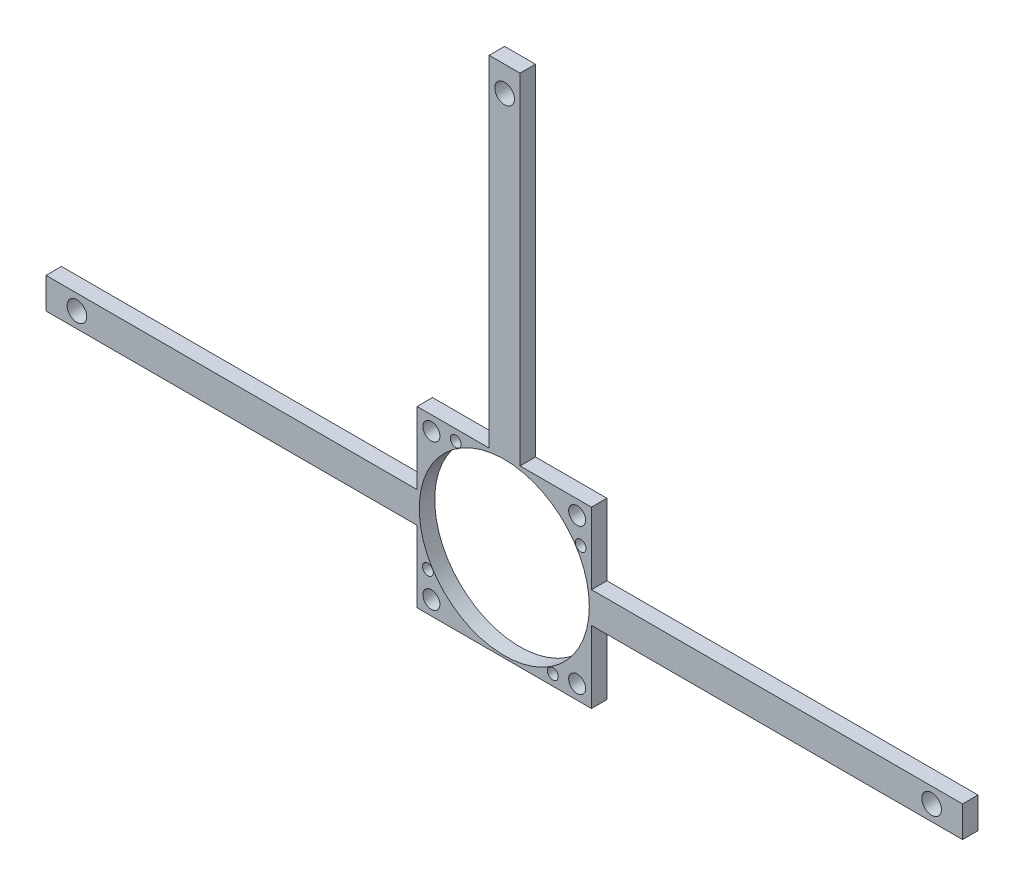
from build123d import *

# Parameters (mm, degrees)
CROQUIS1_R              = 2.75
CROQUIS1_R_2            = 1.75
CROQUIS1_R_3            = 1.747778747
CROQUIS1_R_4            = 7.725412866
SALIENTE_EXTRUIR1_DEPTH = 5
CROQUIS2_R              = 3.175
CROQUIS2_R_2            = 27.5
CORTAR_EXTRUIR1_DEPTH   = 5


with BuildPart() as part:
    # Croquis1 → Saliente-Extruir1 (new body)
    with BuildSketch(Plane.XY):
        Polygon((-28.2, -55.083487529), (-28.2, -31.8), (-4.898409704, -31.8), (-4.898409704, 78.2), (5.101590296, 78.2), (5.101590296, -31.8), (28.2, -31.8), (28.2, -54.916512471), (148.2, -54.916512471), (148.2, -64.916512471), (28.2, -64.916512471), (28.2, -88.2), (-28.2, -88.2), (-28.2, -65.083487529), (-148.2, -65.083487529), (-148.2, -55.083487529), align=None)
        with Locations((-23.57, -36.43)):
            Circle(CROQUIS1_R, mode=Mode.SUBTRACT)
        with Locations((23.57, -36.43)):
            Circle(CROQUIS1_R, mode=Mode.SUBTRACT)
        with Locations((23.57, -83.57)):
            Circle(CROQUIS1_R, mode=Mode.SUBTRACT)
        with Locations((-23.57, -83.57)):
            Circle(CROQUIS1_R, mode=Mode.SUBTRACT)
        with Locations((-15.7, -35.3)):
            Circle(CROQUIS1_R_2, mode=Mode.SUBTRACT)
        with Locations((24.7, -44.3)):
            Circle(CROQUIS1_R_3, mode=Mode.SUBTRACT)
        with Locations((15.7, -84.7)):
            Circle(CROQUIS1_R_2, mode=Mode.SUBTRACT)
        with Locations((-24.7, -75.7)):
            Circle(CROQUIS1_R_2, mode=Mode.SUBTRACT)
        with Locations((0, -60)):
            Circle(CROQUIS1_R_4, mode=Mode.SUBTRACT)
    extrude(amount=SALIENTE_EXTRUIR1_DEPTH)

    # Croquis2 → Cortar-Extruir1 (cut)
    with BuildSketch(Plane.XY.offset(5)):
        with Locations((0.101590296, 70)):
            Circle(CROQUIS2_R)
        with Locations((138.2, -59.916512471)):
            Circle(CROQUIS2_R)
        with Locations((-138.2, -60.083487529)):
            Circle(CROQUIS2_R)
        with Locations((0, -60)):
            Circle(CROQUIS2_R_2)
    extrude(amount=-CORTAR_EXTRUIR1_DEPTH, mode=Mode.SUBTRACT)


solid = part.part
